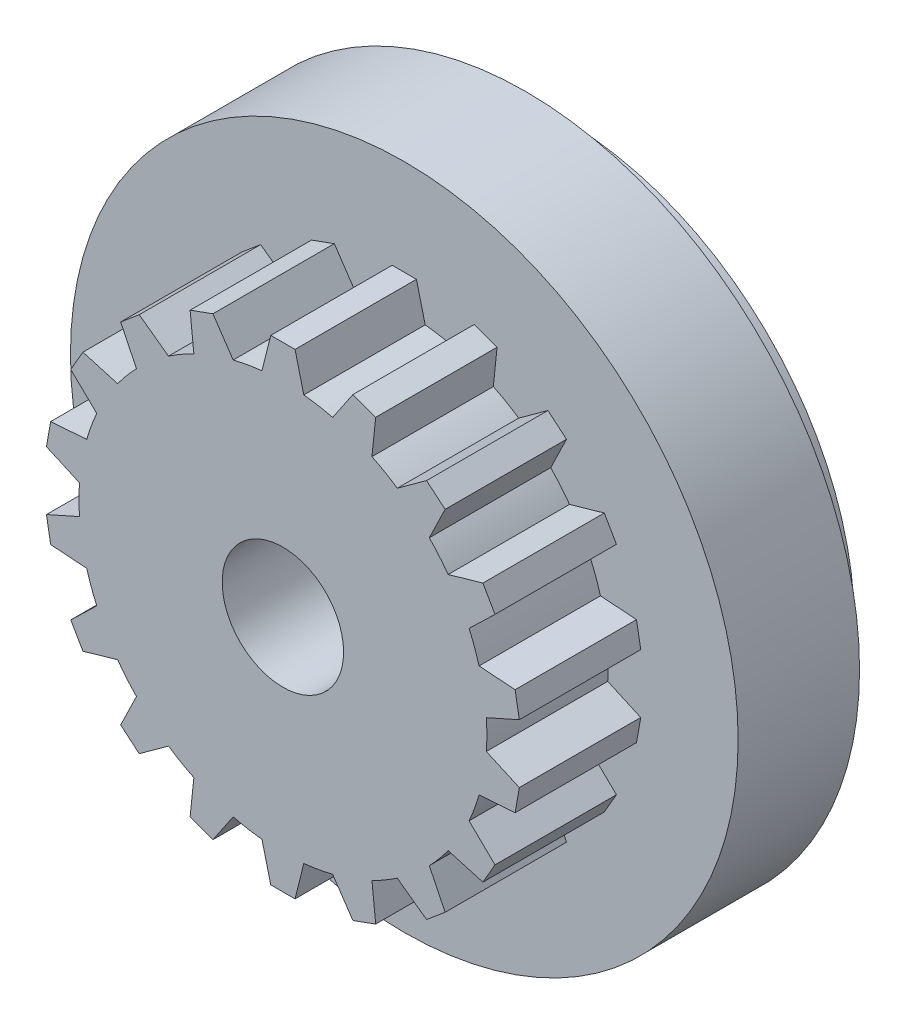
from build123d import *

# Parameters (mm, degrees)
SKETCH1_R           = 10.668
SKETCH1_R_2         = 3.175
BOSS_EXTRUDE1_DEPTH = 6.35
BOSS_EXTRUDE2_DEPTH = 6.35
SKETCH3_R           = 17.4625
BOSS_EXTRUDE3_DEPTH = 6.35
SKETCH4_R           = 1.5875
CUT_EXTRUDE1_DEPTH  = 6.35
SKETCH5_R           = 15.24
SKETCH5_R_2         = 1.5875
BOSS_EXTRUDE4_DEPTH = 1.95072


with BuildPart() as part:
    # Sketch1 → Boss-Extrude1 (new body)
    with BuildSketch(Plane.XY):
        Circle(SKETCH1_R)
        Circle(SKETCH1_R_2, mode=Mode.SUBTRACT)
    extrude(amount=BOSS_EXTRUDE1_DEPTH)

    # Sketch2 → Boss-Extrude2 (add)
    with BuildSketch(Plane.XY.offset(6.35)):
        Polygon((-0.635, 12.446), (0.635, 12.446), (1.27, 9.906), (-1.27, 9.906), align=None)
        Polygon((4.853487518, 11.478231567), (4.581461168, 8.874229519), (2.194641911, 9.742960684), (3.66007789, 11.912597149), align=None)
        Polygon((8.486572812, 9.126019007), (7.340330504, 6.772095989), (5.394577619, 8.404776518), (7.513696369, 9.942359271), align=None)
        Polygon((11.096052176, 5.673073869), (9.21384765, 3.853147737), (7.94384765, 6.052852263), (10.461052176, 6.772926131), align=None)
        Polygon((12.367183887, 1.535872296), (9.976038787, 0.469453002), (9.534972416, 2.970864694), (12.146650701, 2.786578142), align=None)
        Polygon((12.146650701, -2.786578142), (9.534972416, -2.970864694), (9.976038787, -0.469453002), (12.367183887, -1.535872296), align=None)
        Polygon((10.461052176, -6.772926131), (7.94384765, -6.052852263), (9.21384765, -3.853147737), (11.096052176, -5.673073869), align=None)
        Polygon((7.513696369, -9.942359271), (5.394577619, -8.404776518), (7.340330504, -6.772095989), (8.486572812, -9.126019007), align=None)
        Polygon((3.66007789, -11.912597149), (2.194641911, -9.742960684), (4.581461168, -8.874229519), (4.853487518, -11.478231567), align=None)
        Polygon((-0.635, -12.446), (-1.27, -9.906), (1.27, -9.906), (0.635, -12.446), align=None)
        Polygon((-4.853487518, -11.478231567), (-4.581461168, -8.874229519), (-2.194641911, -9.742960684), (-3.66007789, -11.912597149), align=None)
        Polygon((-8.486572812, -9.126019007), (-7.340330504, -6.772095989), (-5.394577619, -8.404776518), (-7.513696369, -9.942359271), align=None)
        Polygon((-11.096052175, -5.673073869), (-9.21384765, -3.853147737), (-7.94384765, -6.052852263), (-10.461052175, -6.772926131), align=None)
        Polygon((-12.367183887, -1.535872296), (-9.976038787, -0.469453002), (-9.534972416, -2.970864694), (-12.146650701, -2.786578142), align=None)
        Polygon((-12.146650701, 2.786578142), (-9.534972416, 2.970864694), (-9.976038787, 0.469453002), (-12.367183887, 1.535872296), align=None)
        Polygon((-10.461052175, 6.772926131), (-7.94384765, 6.052852263), (-9.21384765, 3.853147737), (-11.096052175, 5.673073869), align=None)
        Polygon((-7.513696369, 9.942359271), (-5.394577619, 8.404776518), (-7.340330504, 6.772095989), (-8.486572812, 9.126019007), align=None)
        Polygon((-3.66007789, 11.912597149), (-2.194641911, 9.742960684), (-4.581461168, 8.874229519), (-4.853487518, 11.478231567), align=None)
    extrude(amount=-BOSS_EXTRUDE2_DEPTH)

    # Sketch3 → Boss-Extrude3 (add)
    with BuildSketch(Plane(origin=(0, 0, 0), x_dir=(-1, 0, 0), z_dir=(0, 0, -1))):
        Circle(SKETCH3_R)
    extrude(amount=BOSS_EXTRUDE3_DEPTH)

    # Sketch4 → Cut-Extrude1 (cut)
    with BuildSketch(Plane.XY):
        Circle(SKETCH4_R)
    extrude(amount=-CUT_EXTRUDE1_DEPTH, mode=Mode.SUBTRACT)


with BuildPart() as body_2:
    # Sketch5 → Boss-Extrude4 (new body)
    with BuildSketch(Plane(origin=(0, 0, -6.35), x_dir=(-1, 0, 0), z_dir=(0, 0, -1))):
        Circle(SKETCH5_R)
        Circle(SKETCH5_R_2, mode=Mode.SUBTRACT)
    extrude(amount=BOSS_EXTRUDE4_DEPTH)


solid = Compound([part.part, body_2.part])
